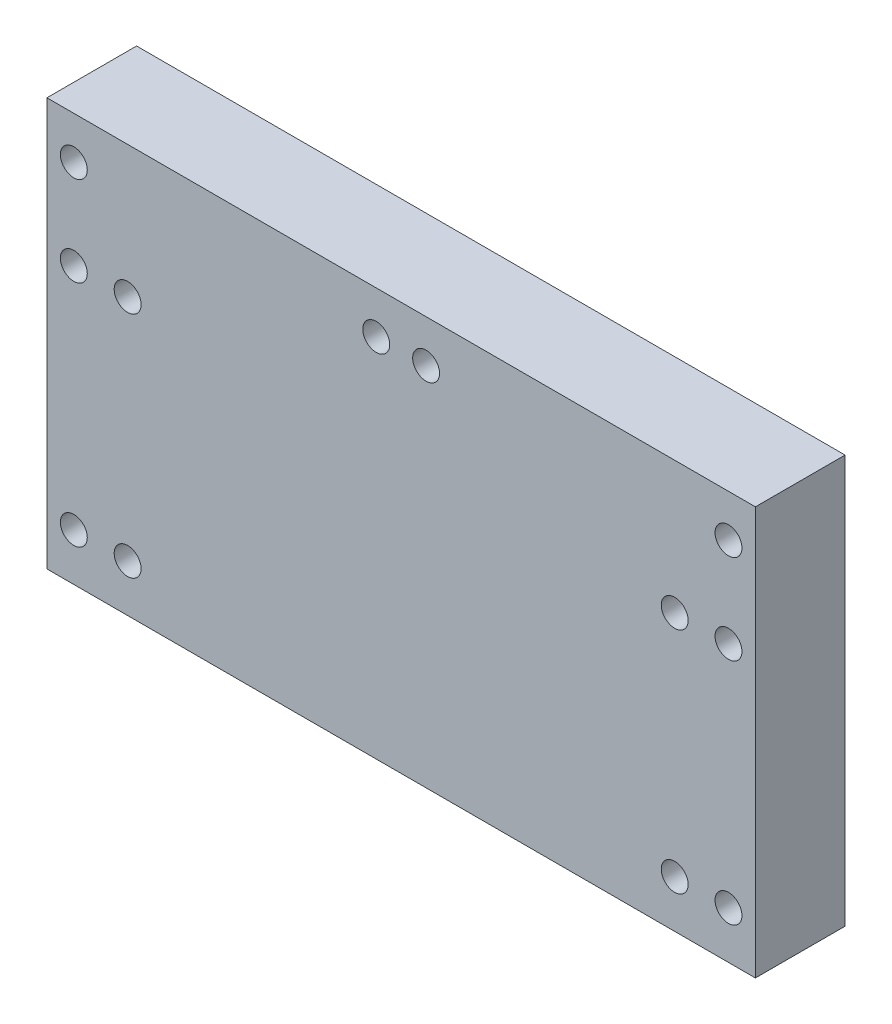
from build123d import *

# Parameters (mm, degrees)
SKETCH_1_R      = 1.5
EXTRUDE_1_DEPTH = 10


with BuildPart() as part:
    # 草图1 → 凸台-拉伸1 (new body)
    # profile 1 of 7: a face of its own
    with BuildSketch(Plane.XY):
        with BuildLine():
            Line((-33.5, 22.75), (-39.5, 22.75))
            Line((-39.5, 22.75), (-39.5, 9.98))
            Line((-39.5, 9.98), (-39.5, -22.75))
            Line((-39.5, -22.75), (-33.5, -22.75))
            Line((-33.5, -22.75), (39.5, -22.75))
            Line((39.5, -22.75), (39.5, 22.75))
            Line((39.5, 22.75), (6, 22.75))
            Line((6, 22.75), (6, 16.75))
            Line((6, 16.75), (3.578873161, 16.75))
            ThreePointArc((3.578873161, 16.75), (2.780687719, 16.52), (1.982502277, 16.75))
            Line((1.982502277, 16.75), (0, 16.75))
            Line((0, 16.75), (-1.982502277, 16.75))
            ThreePointArc((-1.982502277, 16.75), (-2.780687719, 16.52), (-3.578873161, 16.75))
            Line((-3.578873161, 16.75), (-6, 16.75))
            Line((-6, 16.75), (-6, 22.75))
            Line((-6, 22.75), (-33.5, 22.75))
        make_face()
        with Locations((-36.5, -17.48)):
            Circle(SKETCH_1_R, mode=Mode.SUBTRACT)
        with BuildLine():
            ThreePointArc((-29, -17.48), (-30.5, -18.98), (-32, -17.48))
            ThreePointArc((-32, -17.48), (-30.5, -15.98), (-29, -17.48))
        make_face(mode=Mode.SUBTRACT)
        with Locations((30.5, -17.48)):
            Circle(SKETCH_1_R, mode=Mode.SUBTRACT)
        with Locations((36.5, -17.48)):
            Circle(SKETCH_1_R, mode=Mode.SUBTRACT)
        with Locations((-36.5, 8.02)):
            Circle(SKETCH_1_R, mode=Mode.SUBTRACT)
        with BuildLine():
            ThreePointArc((-29, 8.02), (-30.5, 6.52), (-32, 8.02))
            ThreePointArc((-32, 8.02), (-30.5, 9.52), (-29, 8.02))
        make_face(mode=Mode.SUBTRACT)
        with Locations((-36.5, 18.02)):
            Circle(SKETCH_1_R, mode=Mode.SUBTRACT)
        with Locations((30.5, 8.02)):
            Circle(SKETCH_1_R, mode=Mode.SUBTRACT)
        with Locations((36.5, 8.02)):
            Circle(SKETCH_1_R, mode=Mode.SUBTRACT)
        with Locations((36.5, 18.02)):
            Circle(SKETCH_1_R, mode=Mode.SUBTRACT)
    # profile 2 of 7: a face of its own
    with BuildSketch(Plane.XY):
        with BuildLine():
            Line((-33.5, 22.75), (-39.5, 22.75))
            Line((-39.5, 22.75), (-39.5, 9.98))
            Line((-39.5, 9.98), (-39.5, -22.75))
            Line((-39.5, -22.75), (-33.5, -22.75))
            Line((-33.5, -22.75), (39.5, -22.75))
            Line((39.5, -22.75), (39.5, 22.75))
            Line((39.5, 22.75), (6, 22.75))
            Line((6, 22.75), (6, 16.75))
            Line((6, 16.75), (3.578873161, 16.75))
            ThreePointArc((3.578873161, 16.75), (2.780687719, 16.52), (1.982502277, 16.75))
            Line((1.982502277, 16.75), (0, 16.75))
            Line((0, 16.75), (-1.982502277, 16.75))
            ThreePointArc((-1.982502277, 16.75), (-2.780687719, 16.52), (-3.578873161, 16.75))
            Line((-3.578873161, 16.75), (-6, 16.75))
            Line((-6, 16.75), (-6, 22.75))
            Line((-6, 22.75), (-33.5, 22.75))
        make_face()
        with Locations((-36.5, -17.48)):
            Circle(SKETCH_1_R, mode=Mode.SUBTRACT)
        with BuildLine():
            ThreePointArc((-29, -17.48), (-30.5, -18.98), (-32, -17.48))
            ThreePointArc((-32, -17.48), (-30.5, -15.98), (-29, -17.48))
        make_face(mode=Mode.SUBTRACT)
        with Locations((30.5, -17.48)):
            Circle(SKETCH_1_R, mode=Mode.SUBTRACT)
        with Locations((36.5, -17.48)):
            Circle(SKETCH_1_R, mode=Mode.SUBTRACT)
        with Locations((-36.5, 8.02)):
            Circle(SKETCH_1_R, mode=Mode.SUBTRACT)
        with BuildLine():
            ThreePointArc((-29, 8.02), (-30.5, 6.52), (-32, 8.02))
            ThreePointArc((-32, 8.02), (-30.5, 9.52), (-29, 8.02))
        make_face(mode=Mode.SUBTRACT)
        with Locations((-36.5, 18.02)):
            Circle(SKETCH_1_R, mode=Mode.SUBTRACT)
        with Locations((30.5, 8.02)):
            Circle(SKETCH_1_R, mode=Mode.SUBTRACT)
        with Locations((36.5, 8.02)):
            Circle(SKETCH_1_R, mode=Mode.SUBTRACT)
        with Locations((36.5, 18.02)):
            Circle(SKETCH_1_R, mode=Mode.SUBTRACT)
    # profile 3 of 7: a face of its own
    with BuildSketch(Plane.XY):
        with BuildLine():
            Line((-33.5, 22.75), (-39.5, 22.75))
            Line((-39.5, 22.75), (-39.5, 9.98))
            Line((-39.5, 9.98), (-39.5, -22.75))
            Line((-39.5, -22.75), (-33.5, -22.75))
            Line((-33.5, -22.75), (39.5, -22.75))
            Line((39.5, -22.75), (39.5, 22.75))
            Line((39.5, 22.75), (6, 22.75))
            Line((6, 22.75), (6, 16.75))
            Line((6, 16.75), (3.578873161, 16.75))
            ThreePointArc((3.578873161, 16.75), (2.780687719, 16.52), (1.982502277, 16.75))
            Line((1.982502277, 16.75), (0, 16.75))
            Line((0, 16.75), (-1.982502277, 16.75))
            ThreePointArc((-1.982502277, 16.75), (-2.780687719, 16.52), (-3.578873161, 16.75))
            Line((-3.578873161, 16.75), (-6, 16.75))
            Line((-6, 16.75), (-6, 22.75))
            Line((-6, 22.75), (-33.5, 22.75))
        make_face()
        with Locations((-36.5, -17.48)):
            Circle(SKETCH_1_R, mode=Mode.SUBTRACT)
        with BuildLine():
            ThreePointArc((-29, -17.48), (-30.5, -18.98), (-32, -17.48))
            ThreePointArc((-32, -17.48), (-30.5, -15.98), (-29, -17.48))
        make_face(mode=Mode.SUBTRACT)
        with Locations((30.5, -17.48)):
            Circle(SKETCH_1_R, mode=Mode.SUBTRACT)
        with Locations((36.5, -17.48)):
            Circle(SKETCH_1_R, mode=Mode.SUBTRACT)
        with Locations((-36.5, 8.02)):
            Circle(SKETCH_1_R, mode=Mode.SUBTRACT)
        with BuildLine():
            ThreePointArc((-29, 8.02), (-30.5, 6.52), (-32, 8.02))
            ThreePointArc((-32, 8.02), (-30.5, 9.52), (-29, 8.02))
        make_face(mode=Mode.SUBTRACT)
        with Locations((-36.5, 18.02)):
            Circle(SKETCH_1_R, mode=Mode.SUBTRACT)
        with Locations((30.5, 8.02)):
            Circle(SKETCH_1_R, mode=Mode.SUBTRACT)
        with Locations((36.5, 8.02)):
            Circle(SKETCH_1_R, mode=Mode.SUBTRACT)
        with Locations((36.5, 18.02)):
            Circle(SKETCH_1_R, mode=Mode.SUBTRACT)
    # profile 4 of 7: a face of its own
    with BuildSketch(Plane.XY):
        with BuildLine():
            Line((0, 22.75), (-6, 22.75))
            Line((-6, 22.75), (-6, 16.75))
            Line((-6, 16.75), (-3.578873161, 16.75))
            ThreePointArc((-3.578873161, 16.75), (-3.506195071, 19.332874359), (-1.280687719, 18.02))
            ThreePointArc((-1.280687719, 18.02), (-1.46781336, 17.294492648), (-1.982502277, 16.75))
            Line((-1.982502277, 16.75), (0, 16.75))
            Line((0, 16.75), (0, 22.75))
        make_face()
    # profile 5 of 7: a face of its own
    with BuildSketch(Plane.XY):
        with BuildLine():
            Line((6, 22.75), (0, 22.75))
            Line((0, 22.75), (0, 16.75))
            Line((0, 16.75), (1.982502277, 16.75))
            ThreePointArc((1.982502277, 16.75), (2.055180366, 19.332874359), (4.280687719, 18.02))
            ThreePointArc((4.280687719, 18.02), (4.093562078, 17.294492648), (3.578873161, 16.75))
            Line((3.578873161, 16.75), (6, 16.75))
            Line((6, 16.75), (6, 22.75))
        make_face()
    # profile 6 of 7: a face of its own
    with BuildSketch(Plane.XY):
        with BuildLine():
            Line((-33.5, 22.75), (-39.5, 22.75))
            Line((-39.5, 22.75), (-39.5, 9.98))
            Line((-39.5, 9.98), (-39.5, -22.75))
            Line((-39.5, -22.75), (-33.5, -22.75))
            Line((-33.5, -22.75), (39.5, -22.75))
            Line((39.5, -22.75), (39.5, 22.75))
            Line((39.5, 22.75), (6, 22.75))
            Line((6, 22.75), (6, 16.75))
            Line((6, 16.75), (3.578873161, 16.75))
            ThreePointArc((3.578873161, 16.75), (2.780687719, 16.52), (1.982502277, 16.75))
            Line((1.982502277, 16.75), (0, 16.75))
            Line((0, 16.75), (-1.982502277, 16.75))
            ThreePointArc((-1.982502277, 16.75), (-2.780687719, 16.52), (-3.578873161, 16.75))
            Line((-3.578873161, 16.75), (-6, 16.75))
            Line((-6, 16.75), (-6, 22.75))
            Line((-6, 22.75), (-33.5, 22.75))
        make_face()
        with Locations((-36.5, -17.48)):
            Circle(SKETCH_1_R, mode=Mode.SUBTRACT)
        with BuildLine():
            ThreePointArc((-29, -17.48), (-30.5, -18.98), (-32, -17.48))
            ThreePointArc((-32, -17.48), (-30.5, -15.98), (-29, -17.48))
        make_face(mode=Mode.SUBTRACT)
        with Locations((30.5, -17.48)):
            Circle(SKETCH_1_R, mode=Mode.SUBTRACT)
        with Locations((36.5, -17.48)):
            Circle(SKETCH_1_R, mode=Mode.SUBTRACT)
        with Locations((-36.5, 8.02)):
            Circle(SKETCH_1_R, mode=Mode.SUBTRACT)
        with BuildLine():
            ThreePointArc((-29, 8.02), (-30.5, 6.52), (-32, 8.02))
            ThreePointArc((-32, 8.02), (-30.5, 9.52), (-29, 8.02))
        make_face(mode=Mode.SUBTRACT)
        with Locations((-36.5, 18.02)):
            Circle(SKETCH_1_R, mode=Mode.SUBTRACT)
        with Locations((30.5, 8.02)):
            Circle(SKETCH_1_R, mode=Mode.SUBTRACT)
        with Locations((36.5, 8.02)):
            Circle(SKETCH_1_R, mode=Mode.SUBTRACT)
        with Locations((36.5, 18.02)):
            Circle(SKETCH_1_R, mode=Mode.SUBTRACT)
    # profile 7 of 7: a face of its own
    with BuildSketch(Plane.XY):
        with BuildLine():
            Line((-33.5, 22.75), (-39.5, 22.75))
            Line((-39.5, 22.75), (-39.5, 9.98))
            Line((-39.5, 9.98), (-39.5, -22.75))
            Line((-39.5, -22.75), (-33.5, -22.75))
            Line((-33.5, -22.75), (39.5, -22.75))
            Line((39.5, -22.75), (39.5, 22.75))
            Line((39.5, 22.75), (6, 22.75))
            Line((6, 22.75), (6, 16.75))
            Line((6, 16.75), (3.578873161, 16.75))
            ThreePointArc((3.578873161, 16.75), (2.780687719, 16.52), (1.982502277, 16.75))
            Line((1.982502277, 16.75), (0, 16.75))
            Line((0, 16.75), (-1.982502277, 16.75))
            ThreePointArc((-1.982502277, 16.75), (-2.780687719, 16.52), (-3.578873161, 16.75))
            Line((-3.578873161, 16.75), (-6, 16.75))
            Line((-6, 16.75), (-6, 22.75))
            Line((-6, 22.75), (-33.5, 22.75))
        make_face()
        with Locations((-36.5, -17.48)):
            Circle(SKETCH_1_R, mode=Mode.SUBTRACT)
        with BuildLine():
            ThreePointArc((-29, -17.48), (-30.5, -18.98), (-32, -17.48))
            ThreePointArc((-32, -17.48), (-30.5, -15.98), (-29, -17.48))
        make_face(mode=Mode.SUBTRACT)
        with Locations((30.5, -17.48)):
            Circle(SKETCH_1_R, mode=Mode.SUBTRACT)
        with Locations((36.5, -17.48)):
            Circle(SKETCH_1_R, mode=Mode.SUBTRACT)
        with Locations((-36.5, 8.02)):
            Circle(SKETCH_1_R, mode=Mode.SUBTRACT)
        with BuildLine():
            ThreePointArc((-29, 8.02), (-30.5, 6.52), (-32, 8.02))
            ThreePointArc((-32, 8.02), (-30.5, 9.52), (-29, 8.02))
        make_face(mode=Mode.SUBTRACT)
        with Locations((-36.5, 18.02)):
            Circle(SKETCH_1_R, mode=Mode.SUBTRACT)
        with Locations((30.5, 8.02)):
            Circle(SKETCH_1_R, mode=Mode.SUBTRACT)
        with Locations((36.5, 8.02)):
            Circle(SKETCH_1_R, mode=Mode.SUBTRACT)
        with Locations((36.5, 18.02)):
            Circle(SKETCH_1_R, mode=Mode.SUBTRACT)
    extrude(amount=EXTRUDE_1_DEPTH)


solid = part.part
